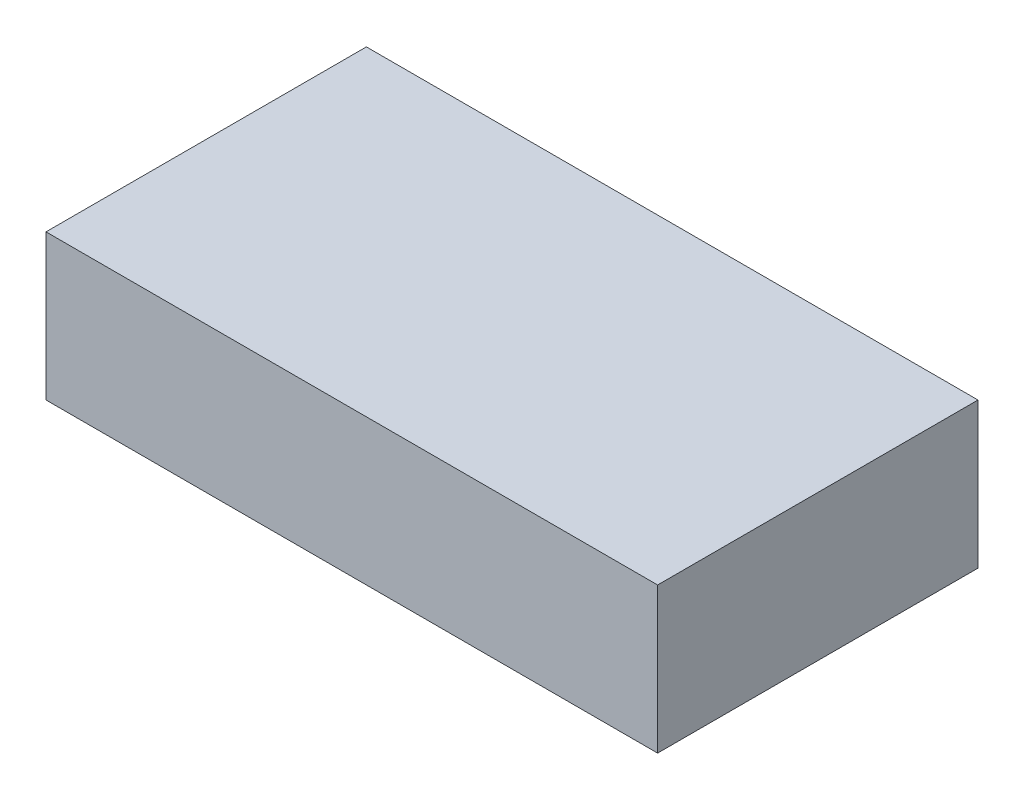
from build123d import *

# Parameters (mm, degrees)
SKIZZE1_W                       = 105
SKIZZE1_H                       = 55
AUFSATZ_LINEAR_AUSTRAGEN1_DEPTH = 25


with BuildPart() as part:
    # Skizze1 → Aufsatz-Linear austragen1 (new body)
    with BuildSketch(Plane(origin=(0, 0, 0), x_dir=(1, 0, 0), z_dir=(0, 1, 0))):
        with Locations((52.5, 27.5)):
            Rectangle(SKIZZE1_W, SKIZZE1_H)
    extrude(amount=AUFSATZ_LINEAR_AUSTRAGEN1_DEPTH)


solid = part.part
